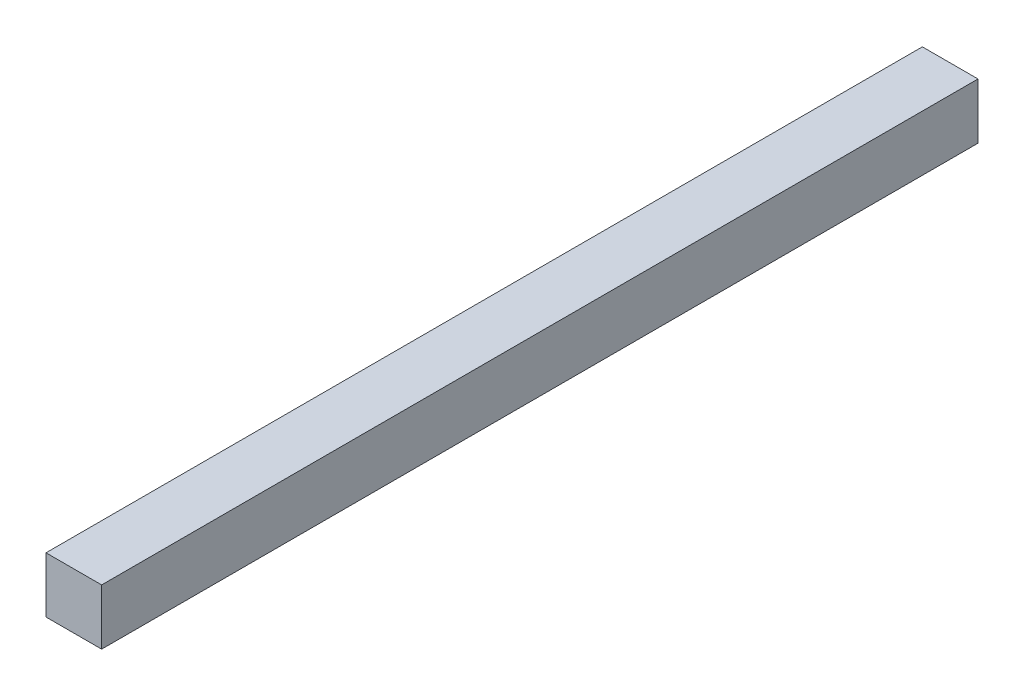
from build123d import *

# Parameters (mm, degrees)
SKETCH1_W           = 3.175
SKETCH1_H           = 3.175
BOSS_EXTRUDE1_DEPTH = 50


with BuildPart() as part:
    # Sketch1 → Boss-Extrude1 (new body)
    with BuildSketch(Plane.XY):
        Rectangle(SKETCH1_W, SKETCH1_H)
    extrude(amount=BOSS_EXTRUDE1_DEPTH)


solid = part.part
